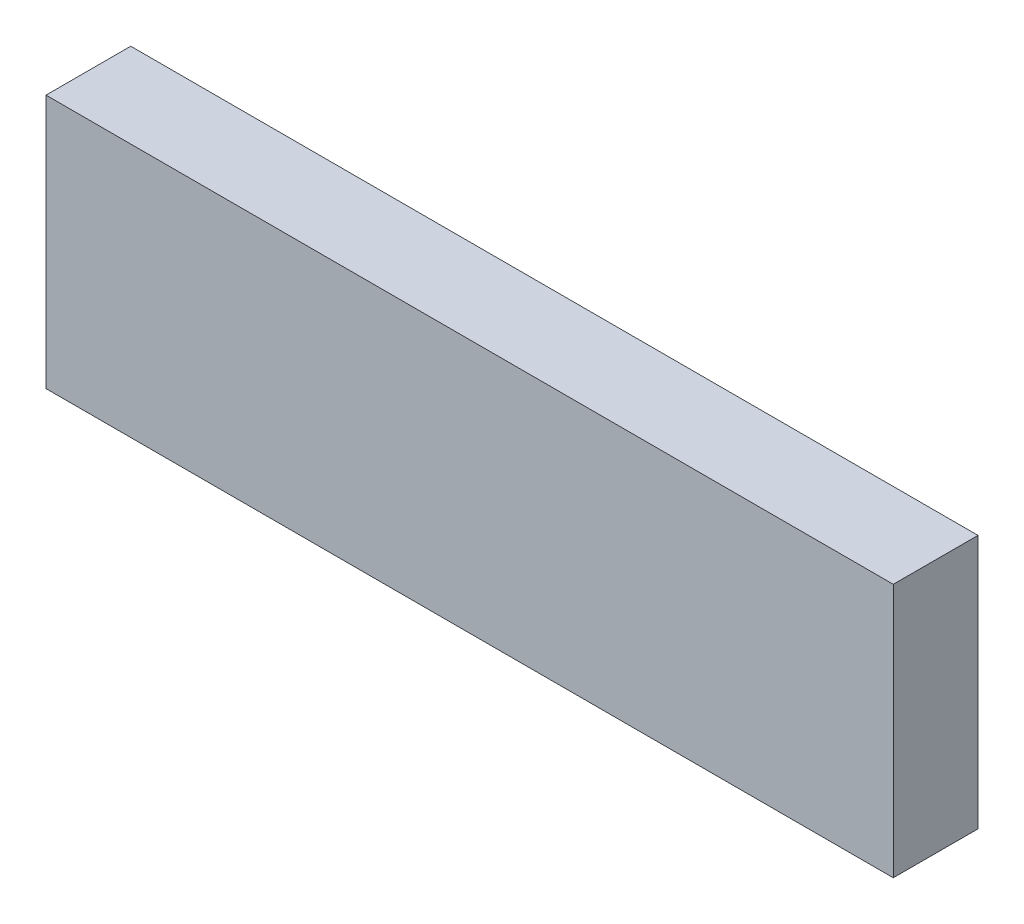
from build123d import *

# Parameters (mm, degrees)
SKETCH1_W           = 127
SKETCH1_H           = 38.1
BOSS_EXTRUDE1_DEPTH = 12.7


with BuildPart() as part:
    # Sketch1 → Boss-Extrude1 (new body)
    with BuildSketch(Plane.XY):
        with Locations((-63.5, 19.05)):
            Rectangle(SKETCH1_W, SKETCH1_H)
    extrude(amount=BOSS_EXTRUDE1_DEPTH)


solid = part.part
